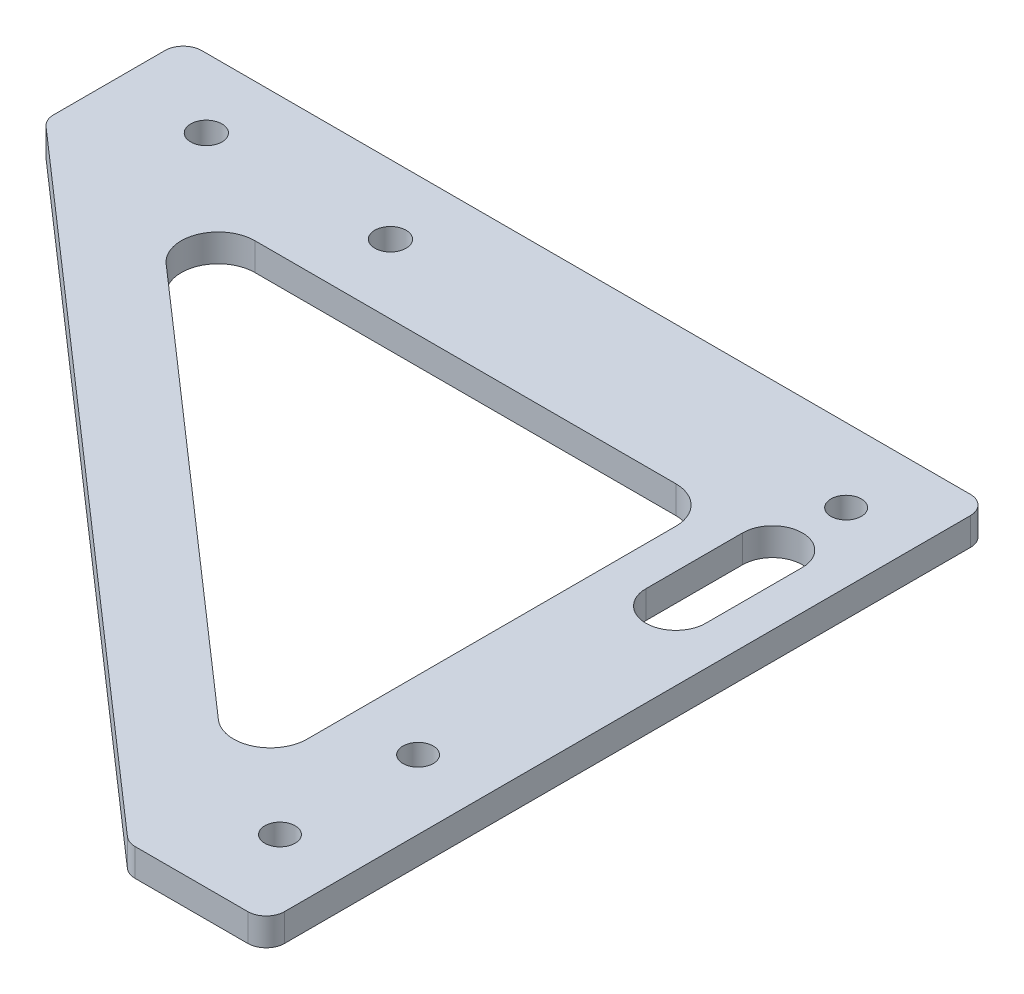
from build123d import *

# Parameters (mm, degrees)
SKETCH_1_R      = 1.65
SKETCH_1_R_2    = 1.7
EXTRUDE_1_DEPTH = 3
FILLET_1_R      = 2


with BuildPart() as part:
    # 草图1 → 凸台-拉伸1 (new body)
    with BuildSketch(Plane(origin=(0, 0, 0), x_dir=(1, 0, 0), z_dir=(0, 1, 0))):
        Polygon((-80, 11.5), (-7.5, -52), (7.5, -52), (7.5, 26.5), (-7.5, 26.5), (-80, 26.5), align=None)
        with Locations(Location((0, 18.5, 0), (0, 0, 270))):
            Circle(SKETCH_1_R, mode=Mode.SUBTRACT)
        with Locations(Location((0, -28, 0), (0, 0, 270))):
            Circle(SKETCH_1_R, mode=Mode.SUBTRACT)
        with Locations(Location((0, -43, 0), (0, 0, 270))):
            Circle(SKETCH_1_R, mode=Mode.SUBTRACT)
        with Locations(Location((-70, 19, 0), (0, 0, 270))):
            Circle(SKETCH_1_R_2, mode=Mode.SUBTRACT)
        with Locations(Location((-50, 19, 0), (0, 0, 270))):
            Circle(SKETCH_1_R_2, mode=Mode.SUBTRACT)
        with BuildLine():
            Line((-3.25, 0), (-3.25, 10.5))
            ThreePointArc((-3.25, 10.5), (0, 13.75), (3.25, 10.5))
            Line((3.25, 10.5), (3.25, 0))
            ThreePointArc((3.25, 0), (0, -3.25), (-3.25, 0))
        make_face(mode=Mode.SUBTRACT)
        with BuildLine():
            Line((-7.5, -32.544518989), (-7.5, 7.5))
            ThreePointArc((-7.5, 7.5), (-8.671572875, 10.328427125), (-11.5, 11.5))
            Line((-11.5, 11.5), (-57.220120105, 11.5))
            ThreePointArc((-57.220120105, 11.5), (-60.964187654, 8.907820368), (-59.855607382, 4.490979094))
            Line((-59.855607382, 4.490979094), (-14.135487277, -35.553539895))
            ThreePointArc((-14.135487277, -35.553539895), (-9.848023775, -36.18745387), (-7.5, -32.544518989))
        make_face(mode=Mode.SUBTRACT)
    extrude(amount=EXTRUDE_1_DEPTH)

    # 圆角1
    fillet_1_edges = [part.edges().sort_by_distance(p)[0] for p in [
        (7.5, 1.5, 52),
        (-7.5, 1.5, 52),
        (-80, 1.5, -11.5),
        (-80, 1.5, -26.5),
        (7.5, 1.5, -26.5),
    ]]
    fillet(fillet_1_edges, radius=FILLET_1_R)


solid = part.part
